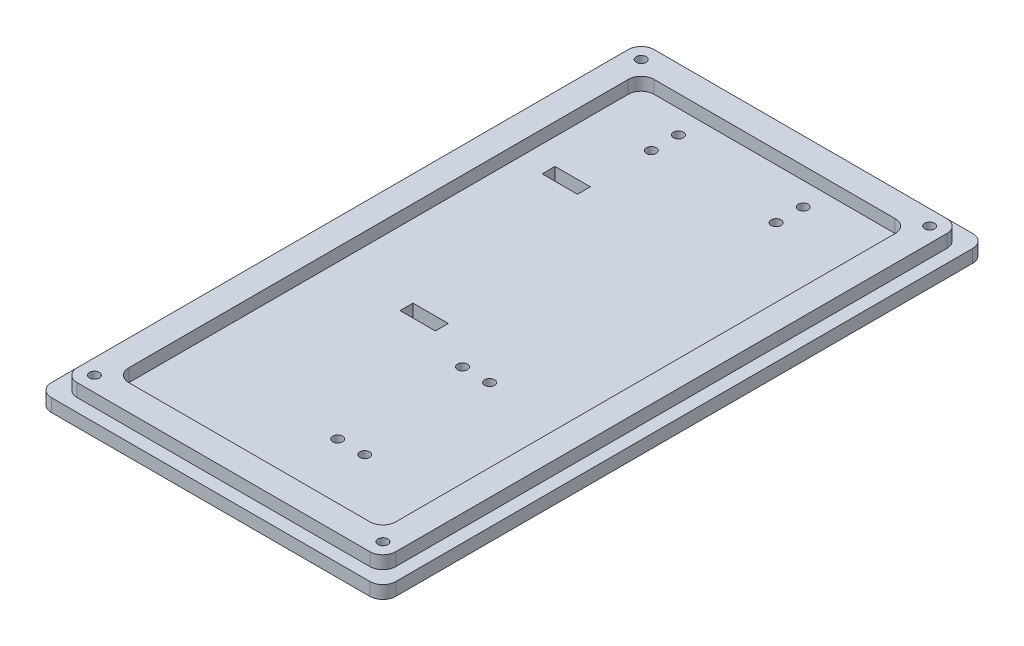
from build123d import *

# Parameters (mm, degrees)
BOSS_EXTRUDE1_DEPTH = 3
BOSS_EXTRUDE2_DEPTH = 3
SKETCH3_R           = 1.15
CUT_EXTRUDE1_DEPTH  = 162.356747612
SKETCH4_W           = 8.2
SKETCH4_H           = 3
CUT_EXTRUDE2_DEPTH  = 10
SKETCH5_R           = 1.15
CUT_EXTRUDE3_DEPTH  = 3
SKETCH6_R           = 1.15
CUT_EXTRUDE4_DEPTH  = 3


with BuildPart() as part:
    # Sketch1 → Boss-Extrude1 (new body)
    with BuildSketch(Plane(origin=(0, 0, 0), x_dir=(1, 0, 0), z_dir=(0, 1, 0))):
        with BuildLine():
            Line((3, 0), (77, 0))
            ThreePointArc((77, 0), (79.121320344, 0.878679656), (80, 3))
            Line((80, 3), (80, 137))
            ThreePointArc((80, 137), (79.121320344, 139.121320344), (77, 140))
            Line((77, 140), (3, 140))
            ThreePointArc((3, 140), (0.878679656, 139.121320344), (0, 137))
            Line((0, 137), (0, 3))
            ThreePointArc((0, 3), (0.878679656, 0.878679656), (3, 0))
        make_face()
    extrude(amount=BOSS_EXTRUDE1_DEPTH)

    # Sketch2 → Boss-Extrude2 (add)
    with BuildSketch(Plane(origin=(0, 3, 0), x_dir=(1, 0, 0), z_dir=(0, 1, 0))):
        with BuildLine():
            Line((6, 137), (74, 137))
            ThreePointArc((74, 137), (76.121320344, 136.121320344), (77, 134))
            Line((77, 134), (77, 6))
            ThreePointArc((77, 6), (76.121320344, 3.878679656), (74, 3))
            Line((74, 3), (6, 3))
            ThreePointArc((6, 3), (3.878679656, 3.878679656), (3, 6))
            Line((3, 6), (3, 134))
            ThreePointArc((3, 134), (3.878679656, 136.121320344), (6, 137))
        make_face()
        with BuildLine():
            Line((12, 131), (68, 131))
            ThreePointArc((68, 131), (70.121320344, 130.121320344), (71, 128))
            Line((71, 128), (71, 12))
            ThreePointArc((71, 12), (70.121320344, 9.878679656), (68, 9))
            Line((68, 9), (12, 9))
            ThreePointArc((12, 9), (9.878679656, 9.878679656), (9, 12))
            Line((9, 12), (9, 128))
            ThreePointArc((9, 128), (9.878679656, 130.121320344), (12, 131))
        make_face(mode=Mode.SUBTRACT)
    extrude(amount=BOSS_EXTRUDE2_DEPTH)

    # Sketch3 → Cut-Extrude1 (cut, through all)
    with BuildSketch(Plane(origin=(0, 6, 0), x_dir=(1, 0, 0), z_dir=(0, 1, 0))):
        with Locations(Location((6.5, 133.5, 0), (0, 0, 270))):
            Circle(SKETCH3_R)
        with Locations(Location((73.5, 133.5, 0), (0, 0, 270))):
            Circle(SKETCH3_R)
        with Locations(Location((73.5, 6.5, 0), (0, 0, 270))):
            Circle(SKETCH3_R)
        with Locations(Location((6.5, 6.5, 0), (0, 0, 270))):
            Circle(SKETCH3_R)
    extrude(amount=-CUT_EXTRUDE1_DEPTH, mode=Mode.SUBTRACT)

    # Sketch4 → Cut-Extrude2 (cut)
    with BuildSketch(Plane.XZ):
        with Locations((30.1, -59.5)):
            Rectangle(SKETCH4_W, SKETCH4_H)
        with Locations((19.1, -103.5)):
            Rectangle(SKETCH4_W, SKETCH4_H)
    extrude(amount=-CUT_EXTRUDE2_DEPTH, mode=Mode.SUBTRACT)

    # Sketch5 → Cut-Extrude3 (cut)
    with BuildSketch(Plane.XZ):
        with Locations(Location((23, -125.65, 0), (0, 0, 270))):
            Circle(SKETCH5_R)
        with Locations(Location((52, -125.65, 0), (0, 0, 270))):
            Circle(SKETCH5_R)
        with Locations(Location((52, -119.35, 0), (0, 0, 270))):
            Circle(SKETCH5_R)
        with Locations(Location((23, -119.35, 0), (0, 0, 270))):
            Circle(SKETCH5_R)
    extrude(amount=-CUT_EXTRUDE3_DEPTH, mode=Mode.SUBTRACT)

    # Sketch6 → Cut-Extrude4 (cut)
    with BuildSketch(Plane.XZ):
        with Locations(Location((50.88, -53.92, 0), (0, 0, 270))):
            Circle(SKETCH6_R)
        with Locations(Location((44.58, -53.92, 0), (0, 0, 270))):
            Circle(SKETCH6_R)
        with Locations(Location((50.88, -24.92, 0), (0, 0, 270))):
            Circle(SKETCH6_R)
        with Locations(Location((44.58, -24.92, 0), (0, 0, 270))):
            Circle(SKETCH6_R)
    extrude(amount=-CUT_EXTRUDE4_DEPTH, mode=Mode.SUBTRACT)


solid = part.part
